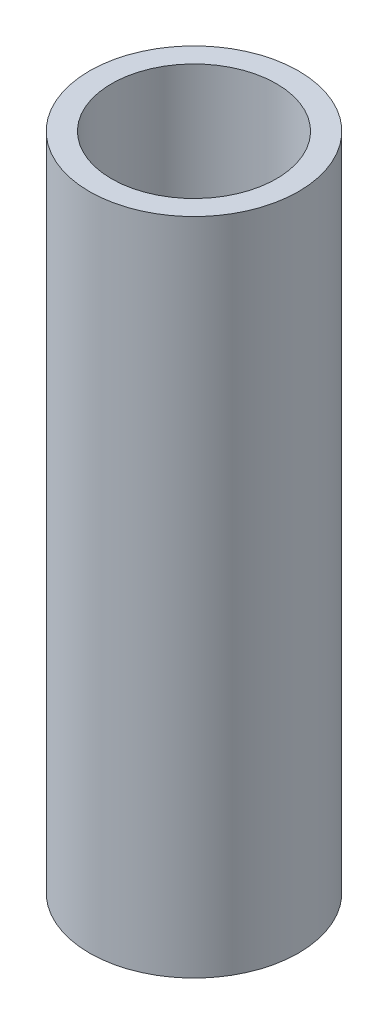
from build123d import *


with BuildPart() as part:
    # Sketch1 → body (revolve)
    with BuildSketch(Plane.XY, mode=Mode.PRIVATE) as body_sk:
        Polygon((-24.1554, 0), (-24.1554, -152.4), (-12.7, -152.4), (-6.35, -128.701477372), (-19.05, -116.001477372), (-19.05, 0), align=None)
    revolve(body_sk.sketch.rotate(Axis((0, 0, 0), (0, -1, 0)), 270), axis=Axis((0, 0, 0), (0, -1, 0)))


solid = part.part
